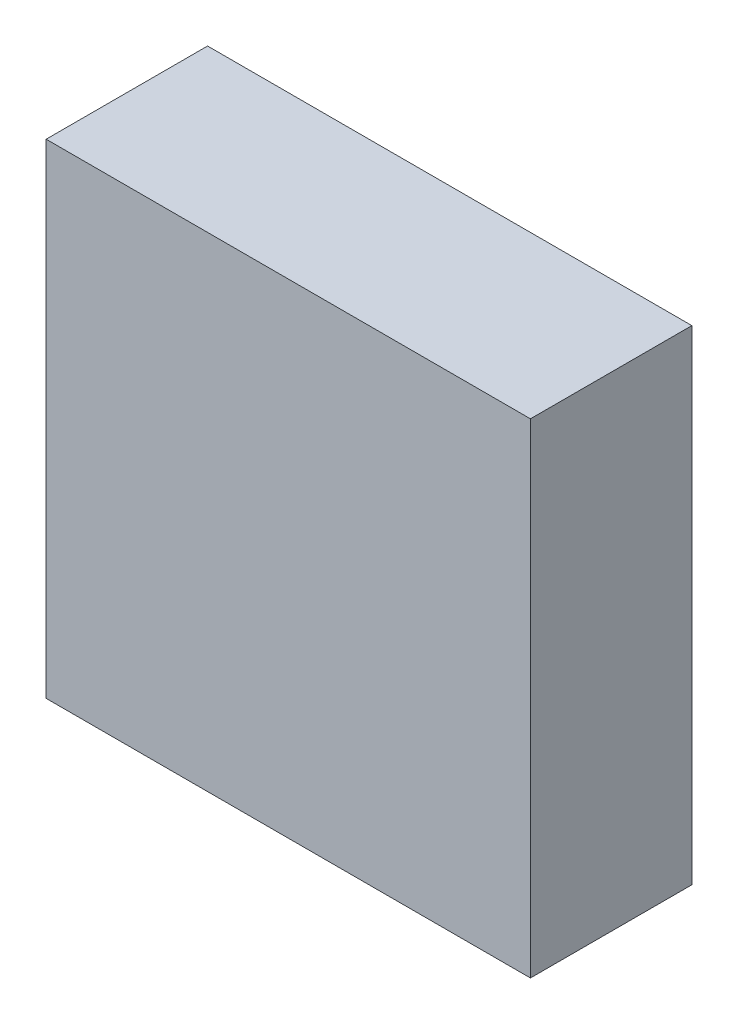
from build123d import *

# Parameters (mm, degrees)
SKETCH_1_W      = 30
SKETCH_1_H      = 30
EXTRUDE_1_DEPTH = 10


with BuildPart() as part:
    # 草图1 → 凸台-拉伸1 (new body)
    with BuildSketch(Plane.XY):
        with Locations((-16.215909039, 12.923091629)):
            Rectangle(SKETCH_1_W, SKETCH_1_H)
    extrude(amount=EXTRUDE_1_DEPTH)


solid = part.part
